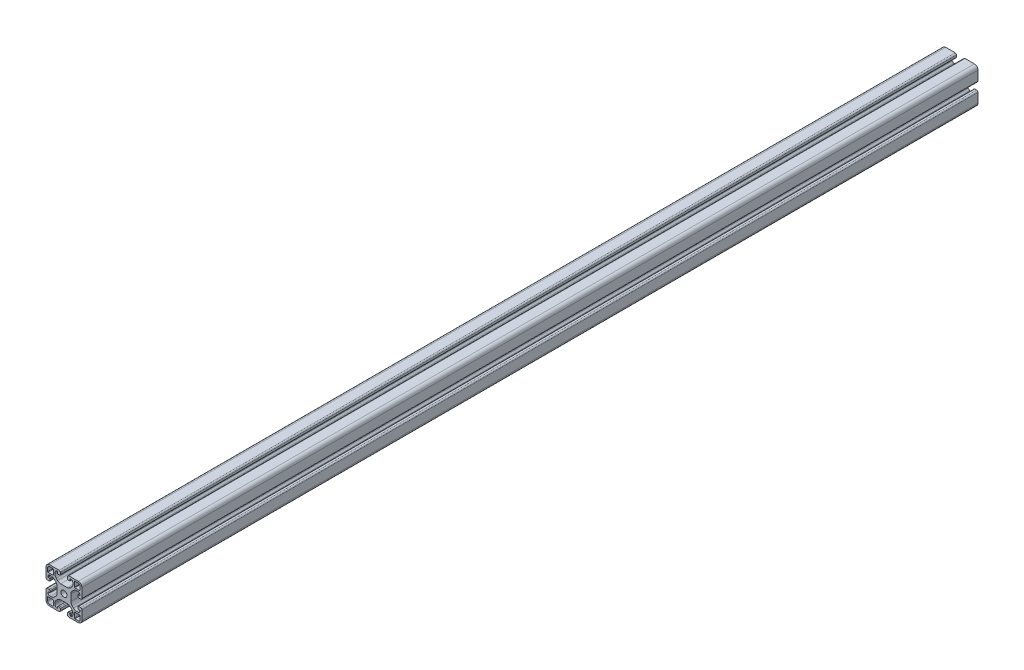
from build123d import *

# Parameters (mm, degrees)
SKETCH1_R           = 3.4
BOSS_EXTRUDE1_DEPTH = 1000


with BuildPart() as part:
    # Sketch1 → Boss-Extrude1 (new body)
    with BuildSketch(Plane.XY):
        with BuildLine():
            Line((0, 36), (0, 25.5))
            ThreePointArc((0, 25.5), (0.439339828, 24.439339828), (1.5, 24))
            Line((1.5, 24), (3.5, 24))
            ThreePointArc((3.5, 24), (4.207106781, 24.292893219), (4.5, 25))
            Line((4.5, 25), (4.5, 26.5))
            ThreePointArc((4.5, 26.5), (4.353553391, 26.853553391), (4, 27))
            Line((4, 27), (2.5, 27))
            ThreePointArc((2.5, 27), (2.146446609, 27.146446609), (2, 27.5))
            ThreePointArc((2, 27.5), (2.732233047, 29.267766953), (4.5, 30))
            Line((4.5, 30), (5.807611845, 30))
            ThreePointArc((5.807611845, 30), (7.721029006, 29.619397663), (9.343145751, 28.535533906))
            Line((9.343145751, 28.535533906), (10.785533906, 27.093145751))
            ThreePointArc((10.785533906, 27.093145751), (11.869397663, 25.471029006), (12.25, 23.557611845))
            Line((12.25, 23.557611845), (12.25, 16.442388155))
            ThreePointArc((12.25, 16.442388155), (11.869397663, 14.528970994), (10.785533906, 12.906854249))
            Line((10.785533906, 12.906854249), (9.343145751, 11.464466094))
            ThreePointArc((9.343145751, 11.464466094), (7.721029006, 10.380602337), (5.807611845, 10))
            Line((5.807611845, 10), (4.5, 10))
            ThreePointArc((4.5, 10), (2.732233047, 10.732233047), (2, 12.5))
            ThreePointArc((2, 12.5), (2.146446609, 12.853553391), (2.5, 13))
            Line((2.5, 13), (4, 13))
            ThreePointArc((4, 13), (4.353553391, 13.146446609), (4.5, 13.5))
            Line((4.5, 13.5), (4.5, 15))
            ThreePointArc((4.5, 15), (4.207106781, 15.707106781), (3.5, 16))
            Line((3.5, 16), (1.5, 16))
            ThreePointArc((1.5, 16), (0.439339828, 15.560660172), (0, 14.5))
            Line((0, 14.5), (0, 4))
            ThreePointArc((0, 4), (1.171572875, 1.171572875), (4, 0))
            Line((4, 0), (14.5, 0))
            ThreePointArc((14.5, 0), (15.560660172, 0.439339828), (16, 1.5))
            Line((16, 1.5), (16, 3.5))
            ThreePointArc((16, 3.5), (15.707106781, 4.207106781), (15, 4.5))
            Line((15, 4.5), (13.5, 4.5))
            ThreePointArc((13.5, 4.5), (13.146446609, 4.353553391), (13, 4))
            Line((13, 4), (13, 2.5))
            ThreePointArc((13, 2.5), (12.853553391, 2.146446609), (12.5, 2))
            ThreePointArc((12.5, 2), (10.732233047, 2.732233047), (10, 4.5))
            Line((10, 4.5), (10, 5.807611845))
            ThreePointArc((10, 5.807611845), (10.380602337, 7.721029006), (11.464466094, 9.343145751))
            Line((11.464466094, 9.343145751), (12.906854249, 10.785533906))
            ThreePointArc((12.906854249, 10.785533906), (14.528970994, 11.869397663), (16.442388155, 12.25))
            Line((16.442388155, 12.25), (23.557611845, 12.25))
            ThreePointArc((23.557611845, 12.25), (25.471029006, 11.869397663), (27.093145751, 10.785533906))
            Line((27.093145751, 10.785533906), (28.535533906, 9.343145751))
            ThreePointArc((28.535533906, 9.343145751), (29.619397663, 7.721029006), (30, 5.807611845))
            Line((30, 5.807611845), (30, 4.5))
            ThreePointArc((30, 4.5), (29.267766953, 2.732233047), (27.5, 2))
            ThreePointArc((27.5, 2), (27.146446609, 2.146446609), (27, 2.5))
            Line((27, 2.5), (27, 4))
            ThreePointArc((27, 4), (26.853553391, 4.353553391), (26.5, 4.5))
            Line((26.5, 4.5), (25, 4.5))
            ThreePointArc((25, 4.5), (24.292893219, 4.207106781), (24, 3.5))
            Line((24, 3.5), (24, 1.5))
            ThreePointArc((24, 1.5), (24.439339828, 0.439339828), (25.5, 0))
            Line((25.5, 0), (36, 0))
            ThreePointArc((36, 0), (38.828427125, 1.171572875), (40, 4))
            Line((40, 4), (40, 14.5))
            ThreePointArc((40, 14.5), (39.560660172, 15.560660172), (38.5, 16))
            Line((38.5, 16), (36.5, 16))
            ThreePointArc((36.5, 16), (35.792893219, 15.707106781), (35.5, 15))
            Line((35.5, 15), (35.5, 13.5))
            ThreePointArc((35.5, 13.5), (35.646446609, 13.146446609), (36, 13))
            Line((36, 13), (37.5, 13))
            ThreePointArc((37.5, 13), (37.853553391, 12.853553391), (38, 12.5))
            ThreePointArc((38, 12.5), (37.267766953, 10.732233047), (35.5, 10))
            Line((35.5, 10), (34.192388155, 10))
            ThreePointArc((34.192388155, 10), (32.278970994, 10.380602337), (30.656854249, 11.464466094))
            Line((30.656854249, 11.464466094), (29.214466094, 12.906854249))
            ThreePointArc((29.214466094, 12.906854249), (28.130602337, 14.528970994), (27.75, 16.442388155))
            Line((27.75, 16.442388155), (27.75, 23.557611845))
            ThreePointArc((27.75, 23.557611845), (28.130602337, 25.471029006), (29.214466094, 27.093145751))
            Line((29.214466094, 27.093145751), (30.656854249, 28.535533906))
            ThreePointArc((30.656854249, 28.535533906), (32.278970994, 29.619397663), (34.192388155, 30))
            Line((34.192388155, 30), (35.5, 30))
            ThreePointArc((35.5, 30), (37.267766953, 29.267766953), (38, 27.5))
            ThreePointArc((38, 27.5), (37.853553391, 27.146446609), (37.5, 27))
            Line((37.5, 27), (36, 27))
            ThreePointArc((36, 27), (35.646446609, 26.853553391), (35.5, 26.5))
            Line((35.5, 26.5), (35.5, 25))
            ThreePointArc((35.5, 25), (35.792893219, 24.292893219), (36.5, 24))
            Line((36.5, 24), (38.5, 24))
            ThreePointArc((38.5, 24), (39.560660172, 24.439339828), (40, 25.5))
            Line((40, 25.5), (40, 36))
            ThreePointArc((40, 36), (38.828427125, 38.828427125), (36, 40))
            Line((36, 40), (25.5, 40))
            ThreePointArc((25.5, 40), (24.439339828, 39.560660172), (24, 38.5))
            Line((24, 38.5), (24, 36.5))
            ThreePointArc((24, 36.5), (24.292893219, 35.792893219), (25, 35.5))
            Line((25, 35.5), (26.5, 35.5))
            ThreePointArc((26.5, 35.5), (26.853553391, 35.646446609), (27, 36))
            Line((27, 36), (27, 37.5))
            ThreePointArc((27, 37.5), (27.146446609, 37.853553391), (27.5, 38))
            ThreePointArc((27.5, 38), (29.267766953, 37.267766953), (30, 35.5))
            Line((30, 35.5), (30, 34.192388155))
            ThreePointArc((30, 34.192388155), (29.619397663, 32.278970994), (28.535533906, 30.656854249))
            Line((28.535533906, 30.656854249), (27.093145751, 29.214466094))
            ThreePointArc((27.093145751, 29.214466094), (25.471029006, 28.130602337), (23.557611845, 27.75))
            Line((23.557611845, 27.75), (16.442388155, 27.75))
            ThreePointArc((16.442388155, 27.75), (14.528970994, 28.130602337), (12.906854249, 29.214466094))
            Line((12.906854249, 29.214466094), (11.464466094, 30.656854249))
            ThreePointArc((11.464466094, 30.656854249), (10.380602337, 32.278970994), (10, 34.192388155))
            Line((10, 34.192388155), (10, 35.5))
            ThreePointArc((10, 35.5), (10.732233047, 37.267766953), (12.5, 38))
            ThreePointArc((12.5, 38), (12.853553391, 37.853553391), (13, 37.5))
            Line((13, 37.5), (13, 36))
            ThreePointArc((13, 36), (13.146446609, 35.646446609), (13.5, 35.5))
            Line((13.5, 35.5), (15, 35.5))
            ThreePointArc((15, 35.5), (15.707106781, 35.792893219), (16, 36.5))
            Line((16, 36.5), (16, 38.5))
            ThreePointArc((16, 38.5), (15.560660172, 39.560660172), (14.5, 40))
            Line((14.5, 40), (4, 40))
            ThreePointArc((4, 40), (1.171572875, 38.828427125), (0, 36))
        make_face()
        with Locations(Location((20, 20, 0), (0, 0, 180))):
            Circle(SKETCH1_R, mode=Mode.SUBTRACT)
        with BuildLine():
            Line((1.8, 4), (1.8, 7.7))
            ThreePointArc((1.8, 7.7), (1.946446609, 8.053553391), (2.3, 8.2))
            Line((2.3, 8.2), (7.7, 8.2))
            ThreePointArc((7.7, 8.2), (8.053553391, 8.053553391), (8.2, 7.7))
            Line((8.2, 7.7), (8.2, 2.3))
            ThreePointArc((8.2, 2.3), (8.053553391, 1.946446609), (7.7, 1.8))
            Line((7.7, 1.8), (4, 1.8))
            ThreePointArc((4, 1.8), (2.444365081, 2.444365081), (1.8, 4))
        make_face(mode=Mode.SUBTRACT)
        with BuildLine():
            Line((4, 38.2), (7.7, 38.2))
            ThreePointArc((7.7, 38.2), (8.053553391, 38.053553391), (8.2, 37.7))
            Line((8.2, 37.7), (8.2, 32.3))
            ThreePointArc((8.2, 32.3), (8.053553391, 31.946446609), (7.7, 31.8))
            Line((7.7, 31.8), (2.3, 31.8))
            ThreePointArc((2.3, 31.8), (1.946446609, 31.946446609), (1.8, 32.3))
            Line((1.8, 32.3), (1.8, 36))
            ThreePointArc((1.8, 36), (2.444365081, 37.555634919), (4, 38.2))
        make_face(mode=Mode.SUBTRACT)
        with BuildLine():
            Line((31.8, 32.3), (31.8, 37.7))
            ThreePointArc((31.8, 37.7), (31.946446609, 38.053553391), (32.3, 38.2))
            Line((32.3, 38.2), (36, 38.2))
            ThreePointArc((36, 38.2), (37.555634919, 37.555634919), (38.2, 36))
            Line((38.2, 36), (38.2, 32.3))
            ThreePointArc((38.2, 32.3), (38.053553391, 31.946446609), (37.7, 31.8))
            Line((37.7, 31.8), (32.3, 31.8))
            ThreePointArc((32.3, 31.8), (31.946446609, 31.946446609), (31.8, 32.3))
        make_face(mode=Mode.SUBTRACT)
        with BuildLine():
            Line((32.3, 8.2), (37.7, 8.2))
            ThreePointArc((37.7, 8.2), (38.053553391, 8.053553391), (38.2, 7.7))
            Line((38.2, 7.7), (38.2, 4))
            ThreePointArc((38.2, 4), (37.555634919, 2.444365081), (36, 1.8))
            Line((36, 1.8), (32.3, 1.8))
            ThreePointArc((32.3, 1.8), (31.946446609, 1.946446609), (31.8, 2.3))
            Line((31.8, 2.3), (31.8, 7.7))
            ThreePointArc((31.8, 7.7), (31.946446609, 8.053553391), (32.3, 8.2))
        make_face(mode=Mode.SUBTRACT)
    extrude(amount=-BOSS_EXTRUDE1_DEPTH)


solid = part.part
